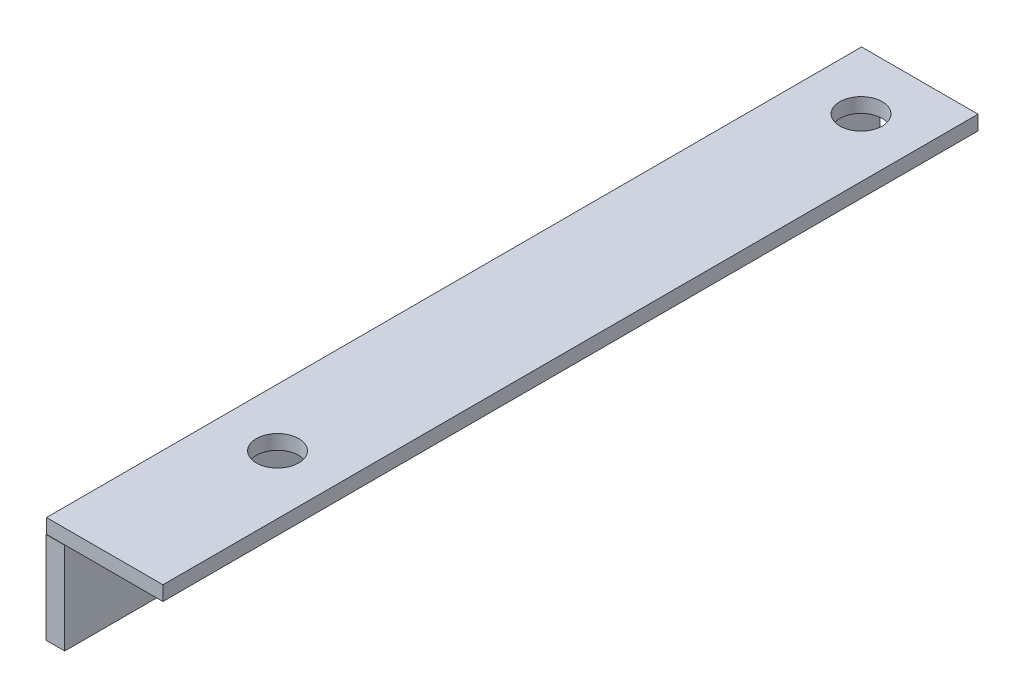
from build123d import *

# Parameters (mm, degrees)
SKETCH1_W           = 12.7
SKETCH1_H           = 88.9
SKETCH1_R           = 2.31
BOSS_EXTRUDE1_DEPTH = 1.5875
SKETCH3_W           = 2.038660884
SKETCH3_H           = 88.935455435
BOSS_EXTRUDE3_DEPTH = 10


with BuildPart() as part:
    # Sketch1 → Boss-Extrude1 (new body)
    with BuildSketch(Plane(origin=(0, 0, 0), x_dir=(1, 0, 0), z_dir=(0, 1, 0))):
        with Locations((6.35, 57.087542426)):
            Rectangle(SKETCH1_W, SKETCH1_H)
        with Locations(Location((6.293214881, 95.187542426, 0), (0, 0, 270))):
            Circle(SKETCH1_R, mode=Mode.SUBTRACT)
        with Locations(Location((6.293214881, 31.537542426, 0), (0, 0, 270))):
            Circle(SKETCH1_R, mode=Mode.SUBTRACT)
    extrude(amount=BOSS_EXTRUDE1_DEPTH)

    # Sketch3 → Boss-Extrude3 (add)
    with BuildSketch(Plane(origin=(0, 0, 0), x_dir=(-1, 0, 0), z_dir=(0, -1, 0))):
        with Locations((-0.999274051, 57.069814709)):
            Rectangle(SKETCH3_W, SKETCH3_H)
    extrude(amount=BOSS_EXTRUDE3_DEPTH)


solid = part.part
